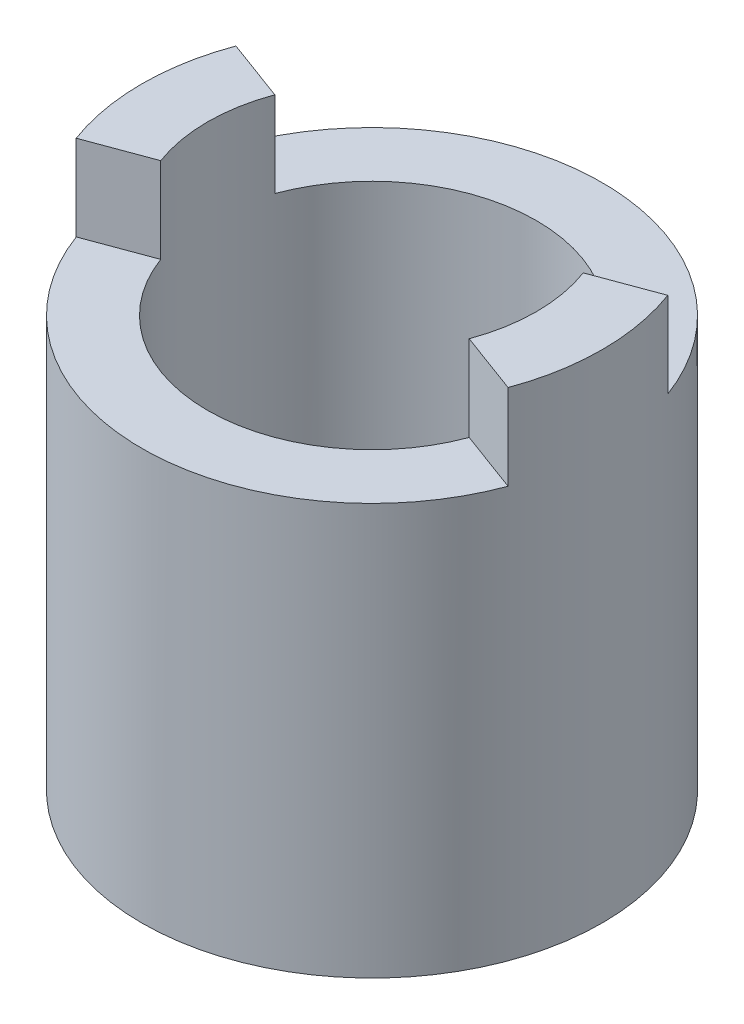
from build123d import *
from build123d.topology import SkipClean

# Parameters (mm, degrees)
SKETCH1_R           = 3.5
SKETCH1_R_2         = 2.5
BOSS_EXTRUDE1_DEPTH = 6.25
BOSS_EXTRUDE2_DEPTH = 1.3


with BuildPart() as part:
    # Sketch1 → Boss-Extrude1 (new body)
    with BuildSketch(Plane(origin=(0, 0, 0), x_dir=(1, 0, 0), z_dir=(0, 1, 0))):
        with Locations(Location((0, 0, 0), (0, 0, 270))):
            Circle(SKETCH1_R)
        with Locations(Location((0, 0, 0), (0, 0, 270))):
            Circle(SKETCH1_R_2, mode=Mode.SUBTRACT)
    extrude(amount=BOSS_EXTRUDE1_DEPTH)

    # Sketch2 → Boss-Extrude2 (add)
    with SkipClean():  # the faces are left unmerged after this step: merging them gives an invalid solid
        with BuildSketch(Plane(origin=(0, 6.25, 0), x_dir=(1, 0, 0), z_dir=(0, 1, 0))):
            with BuildLine():
                Line((2.344759123, 0.867239676), (3.282662772, 1.214135546))
                ThreePointArc((3.282662772, 1.214135546), (3.5, 0), (3.282662772, -1.214135546))
                Line((3.282662772, -1.214135546), (2.344759123, -0.867239676))
                ThreePointArc((2.344759123, -0.867239676), (2.5, 0), (2.344759123, 0.867239676))
            make_face()
            with BuildLine():
                Line((-2.344759123, -0.867239676), (-3.282662772, -1.214135546))
                ThreePointArc((-3.282662772, -1.214135546), (-3.5, 0), (-3.282662772, 1.214135546))
                Line((-3.282662772, 1.214135546), (-2.344759123, 0.867239676))
                ThreePointArc((-2.344759123, 0.867239676), (-2.5, 0), (-2.344759123, -0.867239676))
            make_face()
        extrude(amount=BOSS_EXTRUDE2_DEPTH)


solid = part.part
